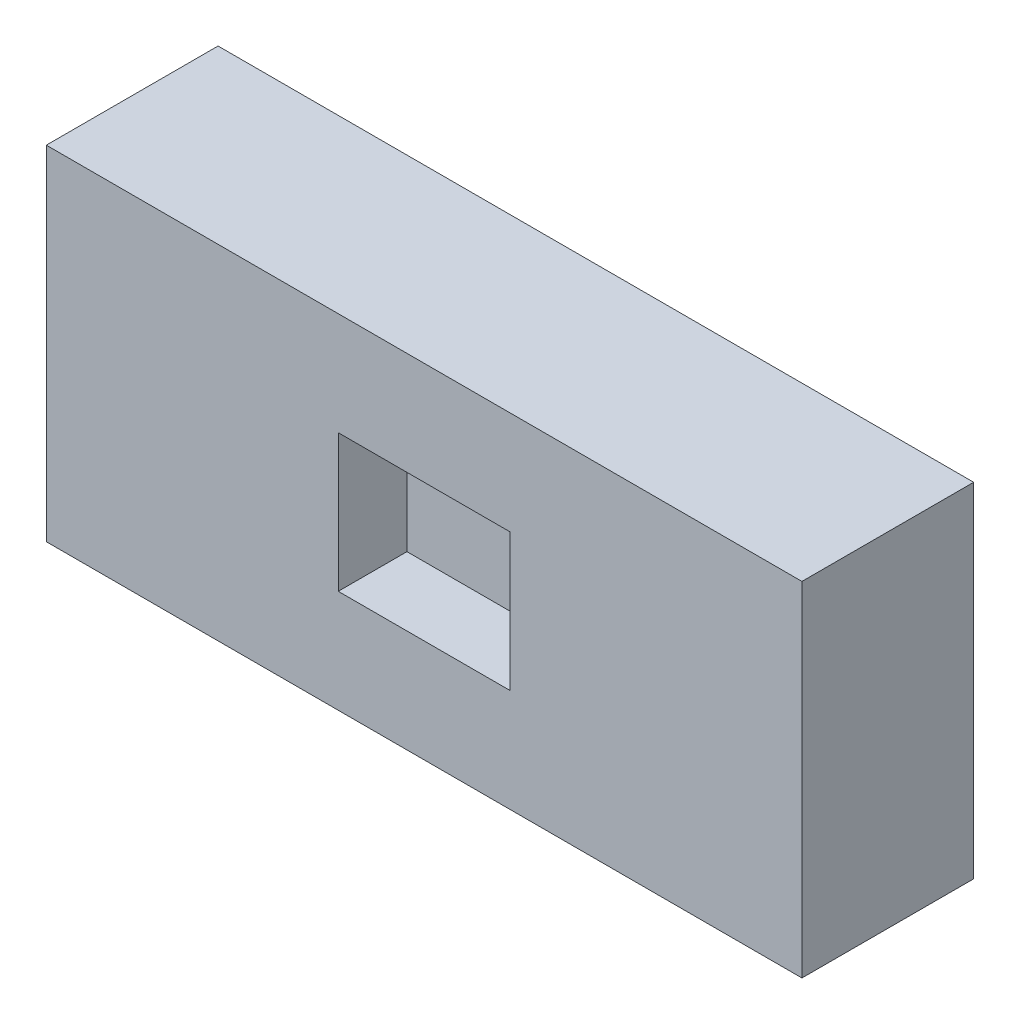
from build123d import *

# Parameters (mm, degrees)
RECTANGLESKETCH_W = 44
RECTANGLESKETCH_H = 20
BLINDBOSS_DEPTH   = 10
CUTSKETCH_W       = 10
CUTSKETCH_H       = 8
BLINDCUT_DEPTH    = 4


with BuildPart() as part:
    # RectangleSketch → BlindBoss (new body)
    with BuildSketch(Plane.XY):
        with Locations((22, 10)):
            Rectangle(RECTANGLESKETCH_W, RECTANGLESKETCH_H)
    extrude(amount=BLINDBOSS_DEPTH)

    # CutSketch → BlindCut (cut)
    with BuildSketch(Plane.XY.offset(10)):
        with Locations((22, 10)):
            Rectangle(CUTSKETCH_W, CUTSKETCH_H)
    extrude(amount=-BLINDCUT_DEPTH, mode=Mode.SUBTRACT)


solid = part.part
